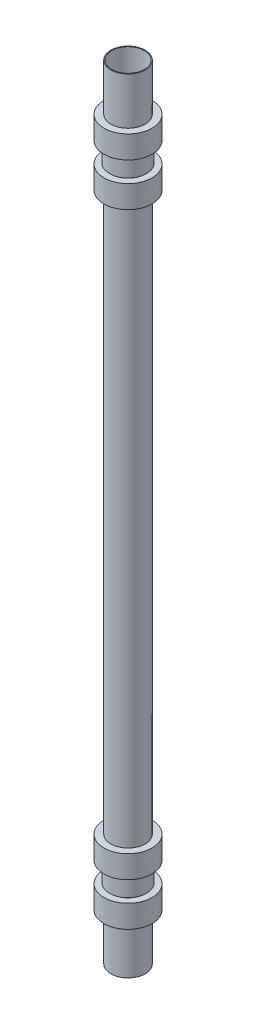
from build123d import *

# Parameters (mm, degrees)
ESBO_O3_W                  = 13.686755529
ESBO_O3_H                  = 42.535935493
ESBO_O4_W                  = 38.680905152
ESBO_O4_H                  = 38.535935493
CORTE_EXTRUS_O1_DEPTH      = 1635.545265364
CORTE_EXTRUS_O1_DEPTH_BACK = 1635.545265364
ESBO_O6_R                  = 34.061990031
ESBO_O7_W                  = 13.69
ESBO_O7_H                  = 42.54
ESBO_O8_W                  = 38.68
ESBO_O8_H                  = 38.54


with BuildPart() as part:
    # Esboço1 → Revolução6 (revolve)
    with BuildSketch(Plane.XY, mode=Mode.PRIVATE) as revolu_o6_sk:
        Polygon((0, 1633), (-35.838224288, 1633), (-35.838224288, 1534.993249603), (-50.245519822, 1534.993249603), (-50.245519822, 1398.116209781), (-35.838224288, 1398.116209781), (-35.838224288, 234.69), (-50.245519822, 234.69), (-50.245519822, 98.01), (-35.838224288, 98.01), (-35.838224288, 0), (0, 0), align=None)
    revolve(revolu_o6_sk.sketch.rotate(Axis((0, 0, 0), (0, 1, 0)), 270), axis=Axis((0, 0, 0), (0, 1, 0)))

    # Esboço3 → Corte-Revolução2 (revolve, cut)
    with BuildSketch(Plane(origin=(0, 0, 0), x_dir=(0, 0, -1), z_dir=(1, 0, 0))):
        with Locations((43.402142058, 1466.554177528)):
            Rectangle(ESBO_O3_W, ESBO_O3_H)
    revolve(axis=Axis((0, 1534.993249603, 0), (0, -1, 0)), mode=Mode.SUBTRACT)

    # Esboço4 → Revolução7 (revolve)
    with BuildSketch(Plane(origin=(0, 0, 0), x_dir=(0, 0, -1), z_dir=(1, 0, 0)), mode=Mode.PRIVATE) as revolu_o7_sk:
        with Locations((19.340452576, 1466.554177528)):
            Rectangle(ESBO_O4_W, ESBO_O4_H)
    revolve(revolu_o7_sk.sketch.rotate(Axis((0, 1487.822145274, 0), (0, -1, 0)), 180), axis=Axis((0, 1487.822145274, 0), (0, -1, 0)))

    # Esboço6 → Corte-extrusão1 (cut, two sides: drawn at the far end of the back side and taken through both)
    with BuildSketch(Plane(origin=(0, 1633, 0), x_dir=(1, 0, 0), z_dir=(0, 1, 0)).offset(-CORTE_EXTRUS_O1_DEPTH_BACK)):
        with Locations(Location((0, 0, 0), (0, 0, 270))):
            Circle(ESBO_O6_R)
    extrude(amount=CORTE_EXTRUS_O1_DEPTH + CORTE_EXTRUS_O1_DEPTH_BACK, mode=Mode.SUBTRACT)

    # Esboço7 → Corte-Revolução3 (revolve, cut)
    with BuildSketch(Plane(origin=(0, 0, 0), x_dir=(0, 0, -1), z_dir=(1, 0, 0)), mode=Mode.PRIVATE) as corte_revolu_o3_sk:
        with Locations((43.400519822, 166.45)):
            Rectangle(ESBO_O7_W, ESBO_O7_H)
    revolve(corte_revolu_o3_sk.sketch.rotate(Axis((0, 234.69, 0), (0, -1, 0)), 180), axis=Axis((0, 234.69, 0), (0, -1, 0)), mode=Mode.SUBTRACT)

    # Esboço8 → Revolução8 (revolve)
    with BuildSketch(Plane.XY, mode=Mode.PRIVATE) as revolu_o8_sk:
        with Locations((19.34, 166.45)):
            Rectangle(ESBO_O8_W, ESBO_O8_H)
    revolve(revolu_o8_sk.sketch.rotate(Axis((0, 145.18, 0), (0, 1, 0)), 270), axis=Axis((0, 145.18, 0), (0, 1, 0)))


solid = part.part
